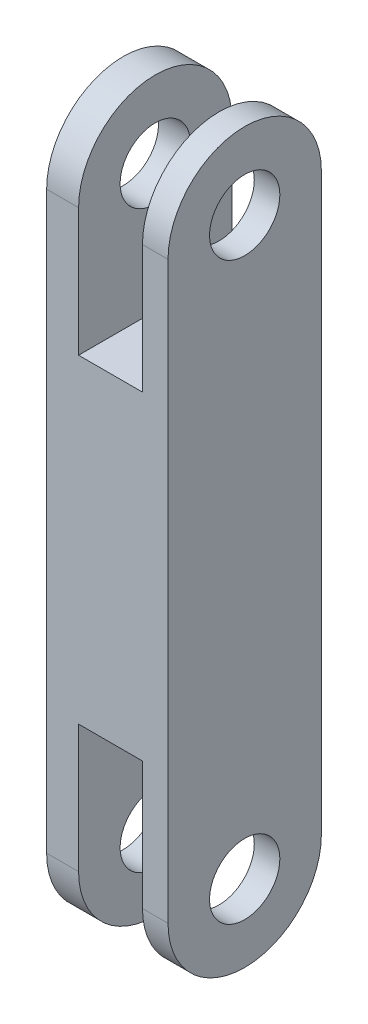
from build123d import *

# Parameters (mm, degrees)
SKETCH1_R           = 2.75
BOSS_EXTRUDE1_DEPTH = 2
SKETCH3_W           = 25
SKETCH3_H           = 12
BOSS_EXTRUDE2_DEPTH = 5
BOSS_EXTRUDE3_START = 2.5
SKETCH4_R           = 2.75
BOSS_EXTRUDE3_DEPTH = 2.5


with BuildPart() as part:
    # Sketch1 → Boss-Extrude1 (new body)
    with BuildSketch(Plane.YZ):
        with BuildLine():
            Line((0, 6), (45, 6))
            ThreePointArc((45, 6), (51, 0), (45, -6))
            Line((45, -6), (0, -6))
            ThreePointArc((0, -6), (-6, 0), (0, 6))
        make_face()
        with Locations(Location((0, 0, 0), (0, 0, 270))):
            Circle(SKETCH1_R, mode=Mode.SUBTRACT)
        with Locations(Location((45, 0, 0), (0, 0, 270))):
            Circle(SKETCH1_R, mode=Mode.SUBTRACT)
    extrude(amount=BOSS_EXTRUDE1_DEPTH)

    # Sketch3 → Boss-Extrude2 (add)
    with BuildSketch(Plane(origin=(0, 0, 0), x_dir=(0, -1, 0), z_dir=(-1, 0, 0))):
        with Locations((-22.5, 0)):
            Rectangle(SKETCH3_W, SKETCH3_H)
    extrude(amount=BOSS_EXTRUDE2_DEPTH)

    # Sketch4 → Boss-Extrude3 (add)
    with BuildSketch(Plane(origin=(-5, 0, 0), x_dir=(0, -1, 0), z_dir=(-1, 0, 0)).offset(BOSS_EXTRUDE3_START)):
        with BuildLine():
            Line((-45, 6), (0, 6))
            ThreePointArc((0, 6), (6, 0), (0, -6))
            Line((0, -6), (-45, -6))
            ThreePointArc((-45, -6), (-51, 0), (-45, 6))
        make_face()
        with Locations(Location((-45, 0, 0), (0, 0, 270))):
            Circle(SKETCH4_R, mode=Mode.SUBTRACT)
        with Locations(Location((0, 0, 0), (0, 0, 270))):
            Circle(SKETCH4_R, mode=Mode.SUBTRACT)
    extrude(amount=-BOSS_EXTRUDE3_DEPTH)


solid = part.part
